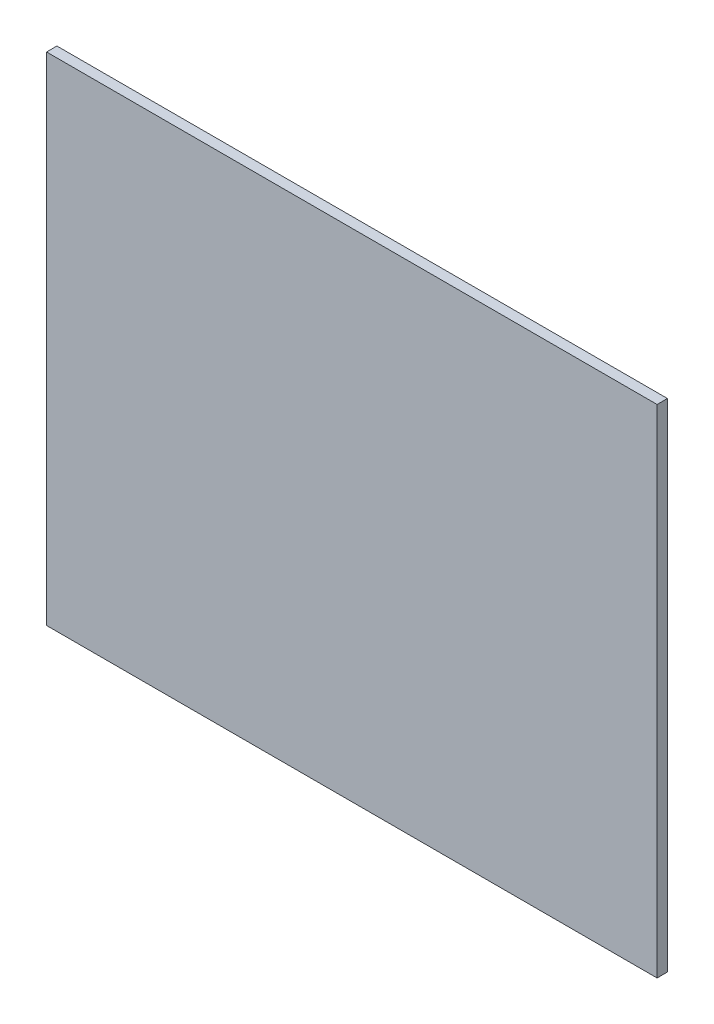
from build123d import *

# Parameters (mm, degrees)
SKETCH2_W           = 295
SKETCH2_H           = 240
BOSS_EXTRUDE1_DEPTH = 5


with BuildPart() as part:
    # Sketch2 → Boss-Extrude1 (new body)
    with BuildSketch(Plane.XY):
        Rectangle(SKETCH2_W, SKETCH2_H)
    extrude(amount=BOSS_EXTRUDE1_DEPTH)


solid = part.part
